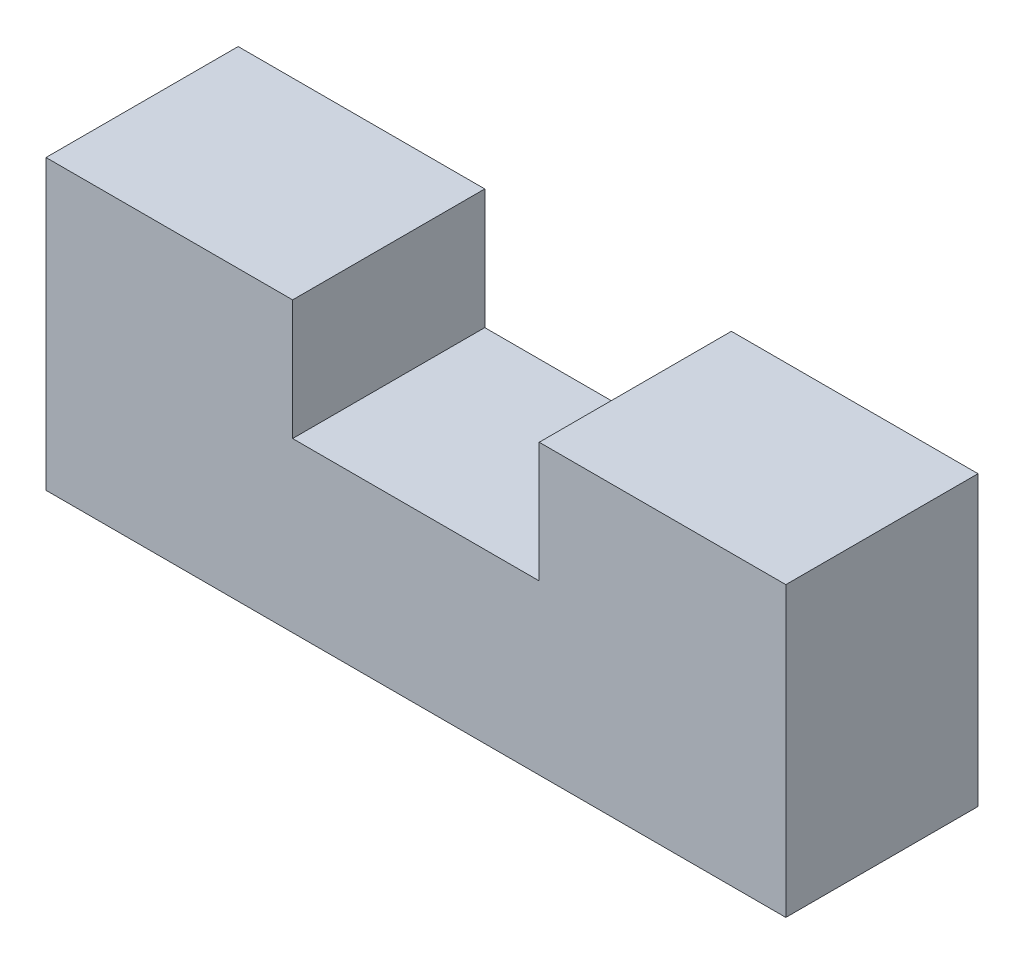
from build123d import *

# Parameters (mm, degrees)
SALIENTE_EXTRUIR2_DEPTH = 40


with BuildPart() as part:
    # Croquis1 → Saliente-Extruir2 (new body)
    with BuildSketch(Plane.XY):
        Polygon((25.666666667, 0), (-25.666666667, 0), (-25.666666667, 25), (-77, 25), (-77, -35), (77, -35), (77, 25), (25.666666667, 25), align=None)
    extrude(amount=SALIENTE_EXTRUIR2_DEPTH)


solid = part.part
